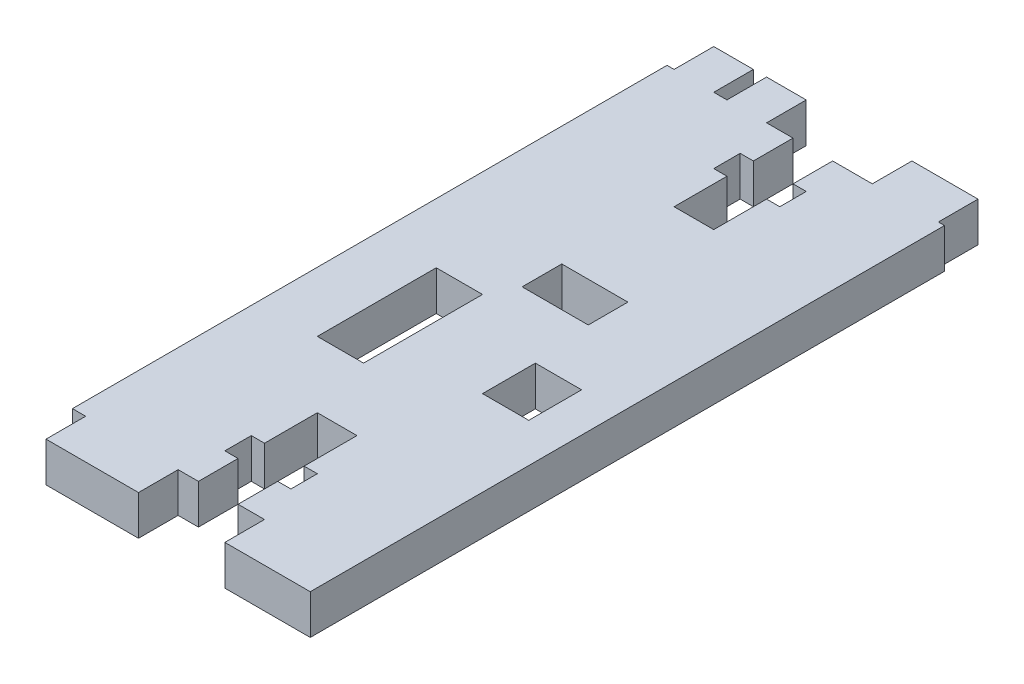
from build123d import *

# Parameters (mm, degrees)
CROQUIS1_W                 = 3.5
CROQUIS1_H                 = 9
CROQUIS1_H_2               = 4
CROQUIS1_W_2               = 5.00348191
CROQUIS1_H_3               = 3.000000003
SALIENTE_EXTRUIR1_DEPTH    = 3
S_LIDO_MOVER_COPIAR1_ANGLE = 90


with BuildPart() as part:
    # Croquis1 → Saliente-Extruir1 (new body)
    with BuildSketch(Plane.XY):
        Polygon((-323.234450912, 58307.505235193), (-323.234450912, 58304.505235193), (-321.699124199, 58304.505235193), (-321.699124199, 58301.505235193), (-322.699124199, 58301.505235193), (-322.699124199, 58299.505235193), (-321.699124199, 58299.505235193), (-321.699124199, 58295.505235193), (-318.699124199, 58295.505235193), (-318.699124199, 58299.505235193), (-317.699124199, 58299.505235193), (-317.699124199, 58301.505235193), (-318.699124199, 58301.505235193), (-318.699124199, 58304.505235193), (-316.699124199, 58304.505235193), (-316.699124199, 58307.505235193), (-310.234450912, 58307.505235193), (-310.234450912, 58259.505235194), (-310.699124199, 58259.505235194), (-310.699124199, 58256.505235193), (-315.699124199, 58256.505235193), (-315.699124199, 58259.505235193), (-318.699124199, 58259.505235193), (-318.699124199, 58262.505235193), (-317.699124199, 58262.505235193), (-317.699124199, 58264.505235193), (-318.699124199, 58264.505235193), (-318.699124199, 58268.505235193), (-321.699124199, 58268.505235193), (-321.699124199, 58264.505235193), (-322.699124199, 58264.505235193), (-322.699124199, 58262.505235193), (-321.699124199, 58262.505235193), (-321.699124199, 58259.505235193), (-323.699124199, 58259.505235193), (-323.699124199, 58256.505235193), (-326.699124199, 58256.505235193), (-326.699124199, 58259.505235193), (-327.699124199, 58259.505235193), (-327.699124199, 58256.505235193), (-330.699124199, 58256.505235193), (-330.699124199, 58259.505235194), (-331.234450912, 58259.505235194), (-331.234450912, 58304.505235193), (-330.234450912, 58304.505235193), (-330.234450912, 58307.505235193), align=None)
        with Locations((-324.949124199, 58286.005235193)):
            Rectangle(CROQUIS1_W, CROQUIS1_H, mode=Mode.SUBTRACT)
        with Locations((-314.949124199, 58286.005235193)):
            Rectangle(CROQUIS1_W, CROQUIS1_H_2, mode=Mode.SUBTRACT)
        with Locations((-319.697383244, 58278.005235192)):
            Rectangle(CROQUIS1_W_2, CROQUIS1_H_3, mode=Mode.SUBTRACT)
    extrude(amount=SALIENTE_EXTRUIR1_DEPTH)


with BuildPart() as part_1:
    # Sólido-Mover/Copiar1: moved
    add(part.part.rotate(Axis((0, 58282.005235193, 1.5), (1, 0, 0)), S_LIDO_MOVER_COPIAR1_ANGLE))


solid = part_1.part
